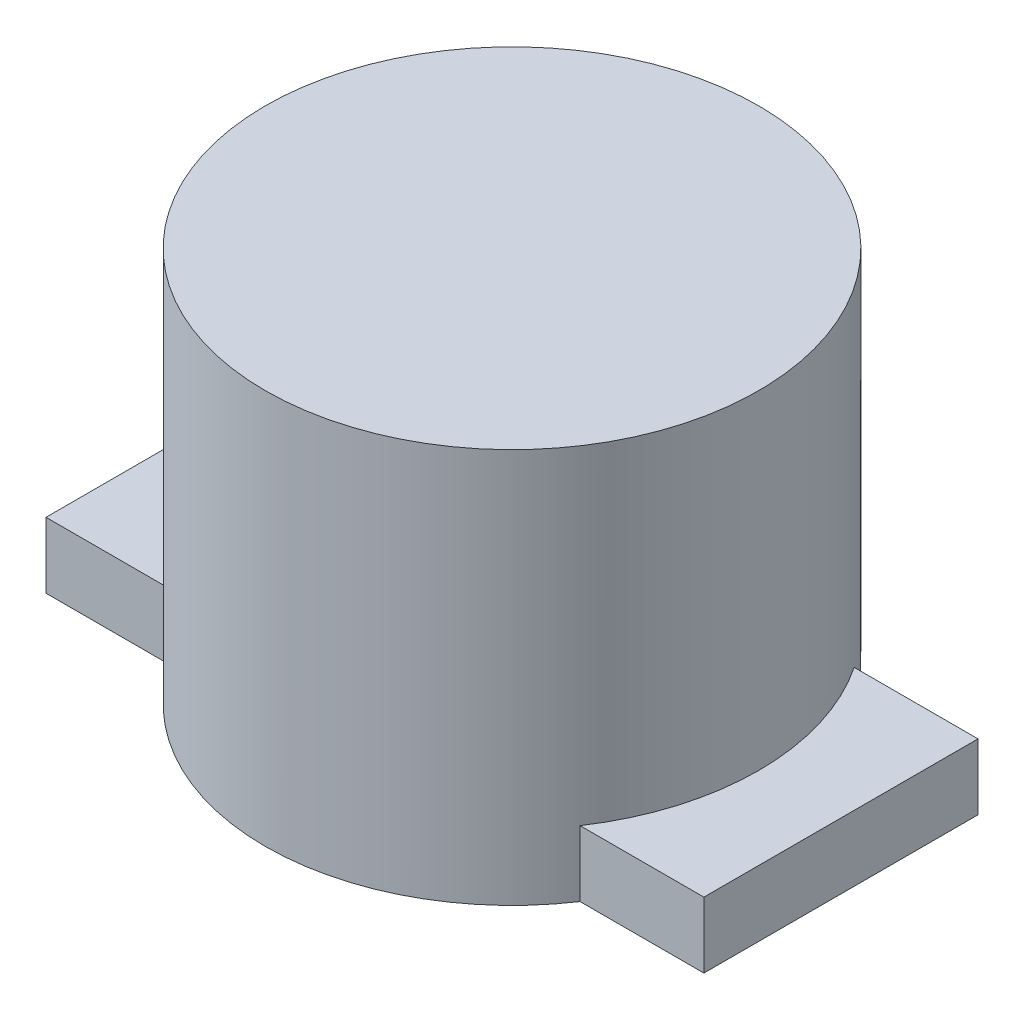
from build123d import *

# Parameters (mm, degrees)
EXTRUDE_1_DEPTH = 1.2
SKETCH_2_R      = 4.5
EXTRUDE_2_DEPTH = 6


with BuildPart() as part:
    # 草图1 → 凸台-拉伸1 (new body)
    with BuildSketch(Plane(origin=(0, 0, 0), x_dir=(1, 0, 0), z_dir=(0, 1, 0))):
        with BuildLine():
            Line((-12, 0), (-9.741657387, 0))
            ThreePointArc((-9.741657387, 0), (-6, -2), (-2.258342613, 0))
            Line((-2.258342613, 0), (0, 0))
            Line((0, 0), (0, 5))
            Line((0, 5), (-2.258342613, 5))
            ThreePointArc((-2.258342613, 5), (-6, 7), (-9.741657387, 5))
            Line((-9.741657387, 5), (-12, 5))
            Line((-12, 5), (-12, 0))
        make_face()
    extrude(amount=EXTRUDE_1_DEPTH)

    # 草图2 → 凸台-拉伸2 (add)
    with BuildSketch(Plane(origin=(0, 1.2, 0), x_dir=(1, 0, 0), z_dir=(0, 1, 0))):
        with Locations(Location((-6, 2.5, 0), (0, 0, 146.251011404))):
            Circle(SKETCH_2_R)
    extrude(amount=EXTRUDE_2_DEPTH)


solid = part.part
